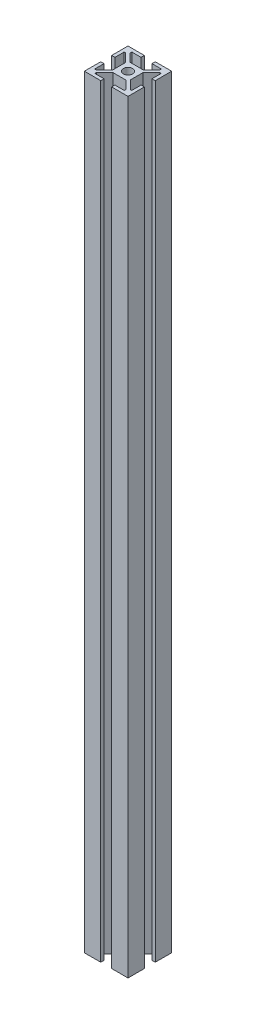
from build123d import *

# Parameters (mm, degrees)
SKETCH1_R           = 2.15
BOSS_EXTRUDE1_DEPTH = 350


with BuildPart() as part:
    # Sketch1 → Boss-Extrude1 (new body)
    with BuildSketch(Plane(origin=(0, 0, 0), x_dir=(1, 0, 0), z_dir=(0, 1, 0))):
        Polygon((-10, 10), (-2.5, 10), (-2.5, 8.499999999), (-6.75, 8.499999999), (-6.75, 7.77515127), (-2.97484873, 4), (2.97484873, 4), (6.75, 7.77515127), (6.75, 8.499999999), (2.5, 8.499999999), (2.5, 10), (10, 10), (10, 2.5), (8.5, 2.5), (8.5, 6.75), (7.846169074, 6.75), (4, 2.903830926), (4, -2.903830926), (7.846169074, -6.75), (8.5, -6.75), (8.5, -2.5), (10, -2.5), (10, -10), (2.5, -10), (2.5, -8.499999999), (6.75, -8.499999999), (6.75, -7.77515127), (2.97484873, -4), (-2.97484873, -4), (-6.75, -7.77515127), (-6.75, -8.499999999), (-2.5, -8.499999999), (-2.5, -10), (-10, -10), (-10, -2.5), (-8.5, -2.5), (-8.5, -6.75), (-7.846169074, -6.75), (-4, -2.903830926), (-4, 2.903830926), (-7.846169074, 6.75), (-8.5, 6.75), (-8.5, 2.5), (-10, 2.5), align=None)
        with Locations(Location((0, 0, 0), (0, 0, 270))):
            Circle(SKETCH1_R, mode=Mode.SUBTRACT)
    extrude(amount=BOSS_EXTRUDE1_DEPTH)


solid = part.part
